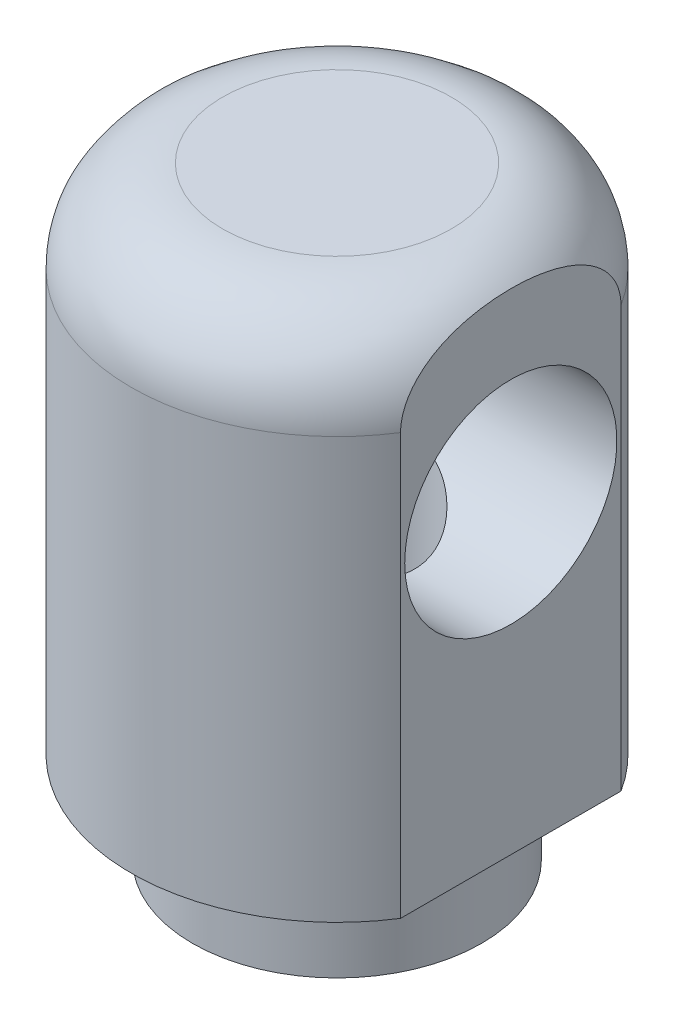
from build123d import *

# Parameters (mm, degrees)
SKETCH1_R               = 11.25
BOSS_EXTRUDE1_DEPTH     = 33
FILLET1_R               = 5
CUT_EXTRUDE1_DEPTH      = 37.635024225
SKETCH3_OUTSIDE_W       = 29.846
SKETCH3_OUTSIDE_H       = 33.346
SKETCH3_OUTSIDE_R       = 7.9
CUT_EXTRUDE2_DEPTH      = 5
SKETCH4_R               = 5.8
CUT_EXTRUDE3_DEPTH      = 40.705950595
CUT_EXTRUDE4_REACH      = 38.136
CUT_EXTRUDE4_END_RADIUS = 5.8
SKETCH5_R               = 4.25


with BuildPart() as part:
    # Sketch1 → Boss-Extrude1 (new body)
    with BuildSketch(Plane(origin=(0, 0, 0), x_dir=(1, 0, 0), z_dir=(0, 1, 0))):
        with Locations(Location((0, 0, 0), (0, 0, 270))):
            Circle(SKETCH1_R)
    extrude(amount=BOSS_EXTRUDE1_DEPTH)

    # Fillet1
    fillet1_edges = [part.edges().sort_by_distance(p)[0] for p in [
        (0, 33, -11.25),
    ]]
    fillet(fillet1_edges, radius=FILLET1_R)

    # Sketch2 → Cut-Extrude1 (cut, through all)
    with BuildSketch(Plane(origin=(0, 33, 0), x_dir=(1, 0, 0), z_dir=(0, 1, 0))):
        with BuildLine():
            Line((-9.5, 6.025985397), (-9.5, -6.025985397))
            ThreePointArc((-9.5, -6.025985397), (-11.25, 0), (-9.5, 6.025985397))
        make_face()
        with BuildLine():
            Line((9.5, 6.025985397), (9.5, -6.025985397))
            ThreePointArc((9.5, -6.025985397), (11.25, 0), (9.5, 6.025985397))
        make_face()
    extrude(amount=-CUT_EXTRUDE1_DEPTH, mode=Mode.SUBTRACT)

    # Sketch3 outside → Cut-Extrude2 (cut)
    with BuildSketch(Plane.XZ):
        Rectangle(SKETCH3_OUTSIDE_W, SKETCH3_OUTSIDE_H)
        with Locations(Location((0, 0, 0), (0, 0, 270))):
            Circle(SKETCH3_OUTSIDE_R, mode=Mode.SUBTRACT)
    extrude(amount=-CUT_EXTRUDE2_DEPTH, mode=Mode.SUBTRACT)

    # Sketch4 → Cut-Extrude3 (cut, through all)
    with BuildSketch(Plane.ZY.offset(9.5)):
        with Locations((0, 21.7)):
            Circle(SKETCH4_R)
    extrude(amount=-CUT_EXTRUDE3_DEPTH, mode=Mode.SUBTRACT)

    # Cut-Extrude4: up to this cylinder (the profile starts outside it)
    cut_extrude4_end = Plane(origin=(0, 21.7, 0), z_dir=(-1, 0, 0)) * Cylinder(CUT_EXTRUDE4_END_RADIUS, 88.872, mode=Mode.PRIVATE)
    # Sketch5 → Cut-Extrude4 (cut, up to the surface)
    with BuildSketch(Plane.XZ, mode=Mode.PRIVATE) as cut_extrude4_sk1:
        with Locations(Location((0, 0, 0), (0, 0, 270))):
            Circle(SKETCH5_R)
    cut_extrude4_tool1 = extrude(cut_extrude4_sk1.sketch, amount=-CUT_EXTRUDE4_REACH, mode=Mode.PRIVATE) - cut_extrude4_end
    add(cut_extrude4_tool1.solids().sort_by_distance((0, 0, 0))[0], mode=Mode.SUBTRACT)


solid = part.part
